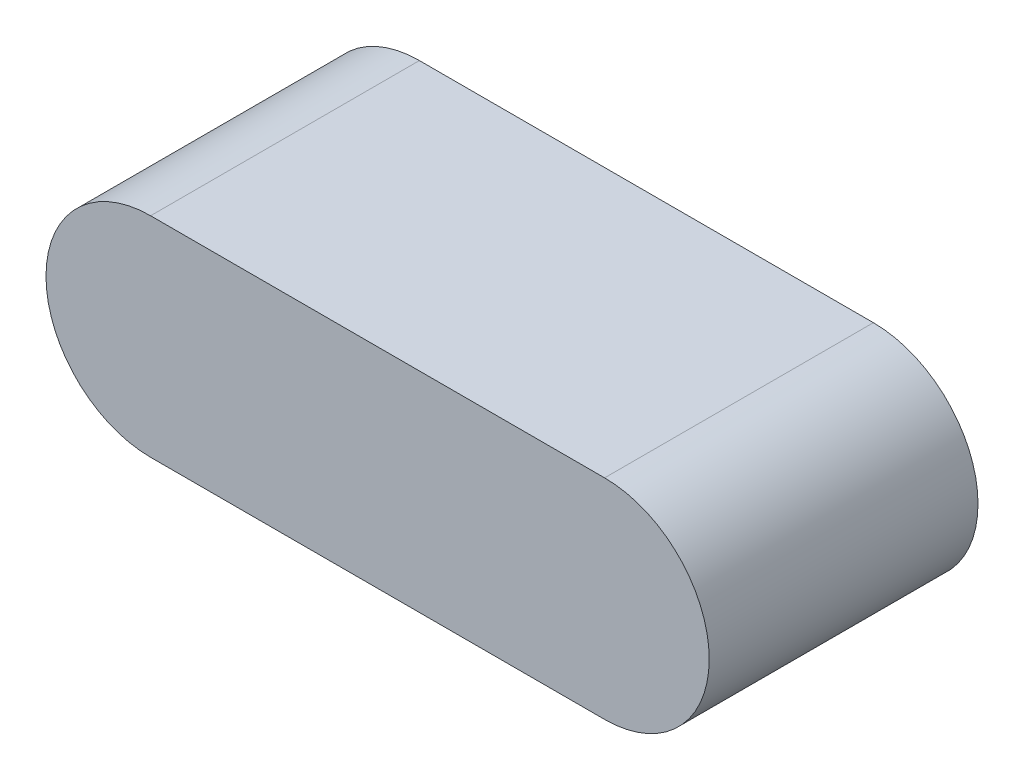
from build123d import *

# Parameters (mm, degrees)
BOSS_EXTRUDE1_START = 20
BOSS_EXTRUDE1_DEPTH = 20
BOSS_EXTRUDE2_DEPTH = 30


with BuildPart() as part:
    # Sketch1 → Boss-Extrude1 (new body)
    with BuildSketch(Plane.XY.offset(BOSS_EXTRUDE1_START)):
        with BuildLine():
            Line((0, 19.458276334), (84.451566673, 19.458276334))
            ThreePointArc((84.451566673, 19.458276334), (103.909843007, 0), (84.451566673, -19.458276334))
            Line((84.451566673, -19.458276334), (0, -19.458276334))
            ThreePointArc((0, -19.458276334), (-19.458276334, 0), (0, 19.458276334))
        make_face()
    extrude(amount=-BOSS_EXTRUDE1_DEPTH)

    # Sketch2 → Boss-Extrude2 (add)
    with BuildSketch(Plane.XY.offset(20)):
        with BuildLine():
            Line((0, -19.458276334), (84.451566673, -19.458276334))
            ThreePointArc((84.451566673, -19.458276334), (103.909843007, 0), (84.451566673, 19.458276334))
            Line((84.451566673, 19.458276334), (0, 19.458276334))
            ThreePointArc((0, 19.458276334), (-19.458276334, 0), (0, -19.458276334))
        make_face()
    extrude(amount=BOSS_EXTRUDE2_DEPTH)


solid = part.part
